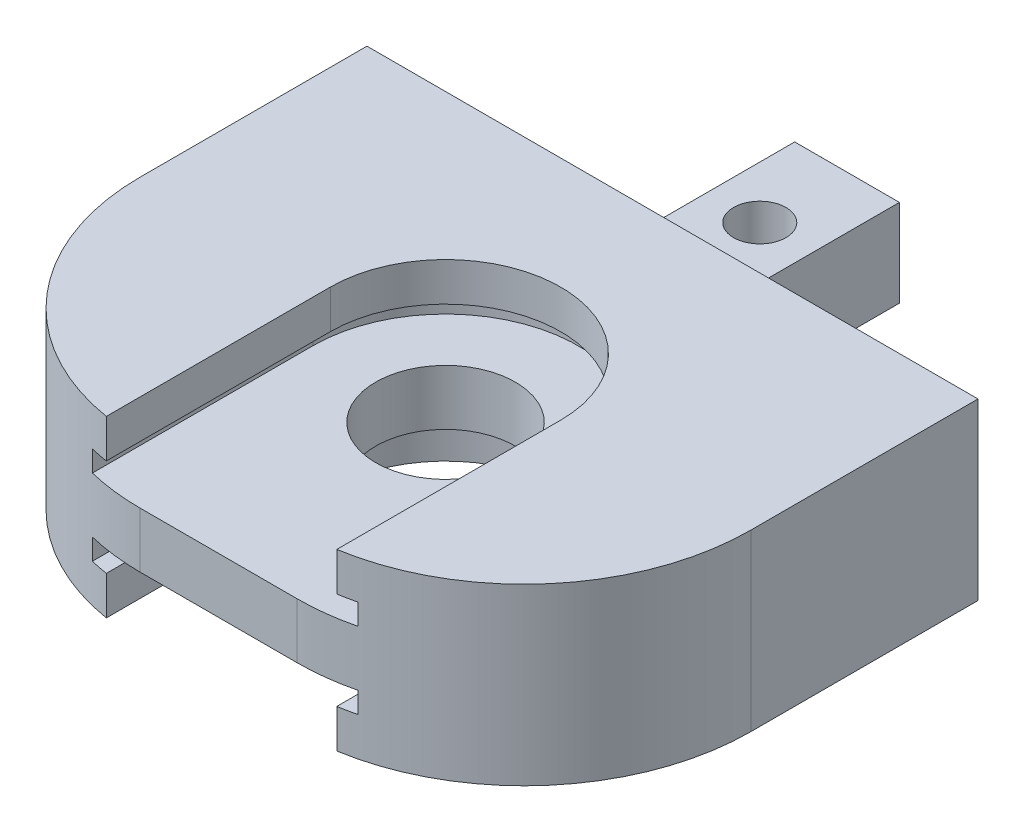
from build123d import *

# Parameters (mm, degrees)
SKETCH1_R           = 1.5
BOSS_EXTRUDE1_DEPTH = 5
SKETCH2_W           = 35
SKETCH2_H           = 2.5
BOSS_EXTRUDE2_DEPTH = 26
FILLET1_R           = 13
CUT_EXTRUDE1_DEPTH  = 13
SKETCH4_R           = 7.6
CUT_EXTRUDE2_DEPTH  = 1.2
SKETCH5_R           = 6.6
CUT_EXTRUDE3_DEPTH  = 50.27874954
CUT_EXTRUDE4_START  = 1.2
SKETCH6_R           = 7.6
CUT_EXTRUDE4_DEPTH  = 1.2
SKETCH7_R           = 6.6
CUT_EXTRUDE5_DEPTH  = 50.27874954
SKETCH8_R           = 4
CUT_EXTRUDE6_DEPTH  = 50.27874954


with BuildPart() as part:
    # Sketch1 → Boss-Extrude1 (new body)
    with BuildSketch(Plane(origin=(0, 0, 0), x_dir=(1, 0, 0), z_dir=(0, 1, 0))):
        Polygon((6, -10), (12.5, -10), (12.5, 0), (18.5, 0), (18.5, -10), (25, -10), (31, -10), (33, -10), (33, -36), (-2, -36), (-2, -10), (0, -10), align=None)
        with Locations(Location((15.5, -5, 0), (0, 0, 270))):
            Circle(SKETCH1_R, mode=Mode.SUBTRACT)
    extrude(amount=BOSS_EXTRUDE1_DEPTH)

    # Sketch2 → Boss-Extrude2 (add)
    with BuildSketch(Plane.XY.offset(36)):
        with Locations((15.5, 6.25)):
            Rectangle(SKETCH2_W, SKETCH2_H)
        with Locations((15.5, -1.25)):
            Rectangle(SKETCH2_W, SKETCH2_H)
    extrude(amount=-BOSS_EXTRUDE2_DEPTH)

    # Fillet1
    fillet1_edges = [part.edges().sort_by_distance(p)[0] for p in [
        (33, 2.5, 36),
        (-2, 2.5, 36),
    ]]
    fillet(fillet1_edges, radius=FILLET1_R)

    # Sketch3 → Cut-Extrude1 (cut)
    with BuildSketch(Plane(origin=(0, 0, 36), x_dir=(-1, 0, 0), z_dir=(0, 0, -1))):
        Polygon((-22.1, 7.5), (-22.1, 5.2875), (-23.1, 5.2875), (-23.1, 4.0875), (-15.5, 4.0875), (-7.9, 4.0875), (-7.9, 5.2875), (-8.9, 5.2875), (-8.9, 7.5), align=None)
    cut_extrude1 = extrude(amount=CUT_EXTRUDE1_DEPTH, mode=Mode.SUBTRACT)

    # Sketch4 → Cut-Extrude2 (cut)
    with BuildSketch(Plane(origin=(0, 4.0875, 0), x_dir=(1, 0, 0), z_dir=(0, 1, 0))):
        with Locations((15.5, -23)):
            Circle(SKETCH4_R)
    extrude(amount=CUT_EXTRUDE2_DEPTH, mode=Mode.SUBTRACT)

    # Sketch5 → Cut-Extrude3 (cut, through all)
    with BuildSketch(Plane(origin=(0, 4.0875, 0), x_dir=(1, 0, 0), z_dir=(0, 1, 0))):
        with Locations((15.5, -23)):
            Circle(SKETCH5_R)
    extrude(amount=CUT_EXTRUDE3_DEPTH, mode=Mode.SUBTRACT)

    # Mirror1: Cut-Extrude1 across plane
    add(cut_extrude1.mirror(Plane(origin=(0, 2.5, 0), x_dir=(0, 0, 1), z_dir=(0, -1, 0))), mode=Mode.SUBTRACT)

    # Sketch6 → Cut-Extrude4 (cut)
    with BuildSketch(Plane.XZ.offset(-0.9125).offset(CUT_EXTRUDE4_START)):
        with Locations((15.5, 23)):
            Circle(SKETCH6_R)
    extrude(amount=-CUT_EXTRUDE4_DEPTH, mode=Mode.SUBTRACT)

    # Sketch7 → Cut-Extrude5 (cut, through all)
    with BuildSketch(Plane.XZ.offset(-0.9125)):
        with Locations((15.5, 23)):
            Circle(SKETCH7_R)
    extrude(amount=CUT_EXTRUDE5_DEPTH, mode=Mode.SUBTRACT)

    # Sketch8 → Cut-Extrude6 (cut, through all)
    with BuildSketch(Plane(origin=(0, 4.0875, 0), x_dir=(1, 0, 0), z_dir=(0, 1, 0))):
        with Locations(Location((15.5, -23, 0), (0, 0, 270))):
            Circle(SKETCH8_R)
    extrude(amount=-CUT_EXTRUDE6_DEPTH, mode=Mode.SUBTRACT)


solid = part.part
